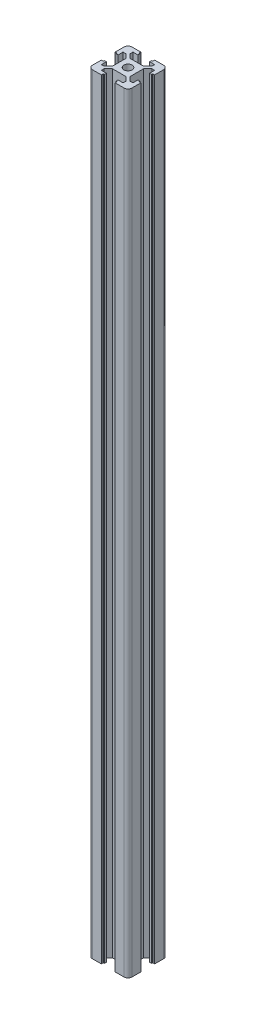
from build123d import *

# Parameters (mm, degrees)
EXTRUDE_1_DEPTH     = 390
FILLET_1_R          = 2
FILLET_2_R          = 0.2
SKETCH_4_R          = 2.1
CUT_EXTRUDE_1_DEPTH = 391.256326022


with BuildPart() as part:
    # Эскиз3 → Бобышка-Вытянуть1 (new body)
    with BuildSketch(Plane(origin=(0, 0, 0), x_dir=(1, 0, 0), z_dir=(0, 1, 0))):
        Polygon((-10, -10), (-3.5, -10), (-3.5, -9), (-3, -9), (-3, -8), (-5.5, -8), (-5.5, -6.560660172), (-3.439339828, -4.5), (3.439339828, -4.5), (5.5, -6.560660172), (5.5, -8), (3, -8), (3, -9), (3.5, -9), (3.5, -10), (10, -10), (10, -3.5), (9, -3.5), (9, -3), (8, -3), (8, -5.5), (6.560660172, -5.5), (4.5, -3.439339828), (4.5, 3.439339828), (6.560660172, 5.5), (8, 5.5), (8, 3), (9, 3), (9, 3.5), (10, 3.5), (10, 10), (3.5, 10), (3.5, 9), (3, 9), (3, 8), (5.5, 8), (5.5, 6.560660172), (3.439339828, 4.5), (-3.439339828, 4.5), (-5.5, 6.560660172), (-5.5, 8), (-3, 8), (-3, 9), (-3.5, 9), (-3.5, 10), (-10, 10), (-10, 3.5), (-9, 3.5), (-9, 3), (-8, 3), (-8, 5.5), (-6.560660172, 5.5), (-4.5, 3.439339828), (-4.5, -3.439339828), (-6.560660172, -5.5), (-8, -5.5), (-8, -3), (-9, -3), (-9, -3.5), (-10, -3.5), align=None)
    extrude(amount=EXTRUDE_1_DEPTH)

    # Скругление1
    fillet_1_edges = [part.edges().sort_by_distance(p)[0] for p in [
        (-10, 195, 10),
        (-10, 195, -10),
        (10, 195, -10),
        (10, 195, 10),
    ]]
    fillet(fillet_1_edges, radius=FILLET_1_R)

    # Скругление2
    fillet_2_edges = [part.edges().sort_by_distance(p)[0] for p in [
        (-3.5, 195, 9),
        (-9, 195, 3.5),
        (-9, 195, -3.5),
        (-3.5, 195, -9),
        (3.5, 195, -9),
        (9, 195, -3.5),
        (9, 195, 3.5),
        (3.5, 195, 9),
    ]]
    fillet(fillet_2_edges, radius=FILLET_2_R)

    # Эскиз4 → Вырез-Вытянуть1 (cut, through all)
    with BuildSketch(Plane(origin=(0, 390, 0), x_dir=(1, 0, 0), z_dir=(0, 1, 0))):
        with Locations(Location((0, 0, 0), (0, 0, 270))):
            Circle(SKETCH_4_R)
    extrude(amount=-CUT_EXTRUDE_1_DEPTH, mode=Mode.SUBTRACT)


solid = part.part
